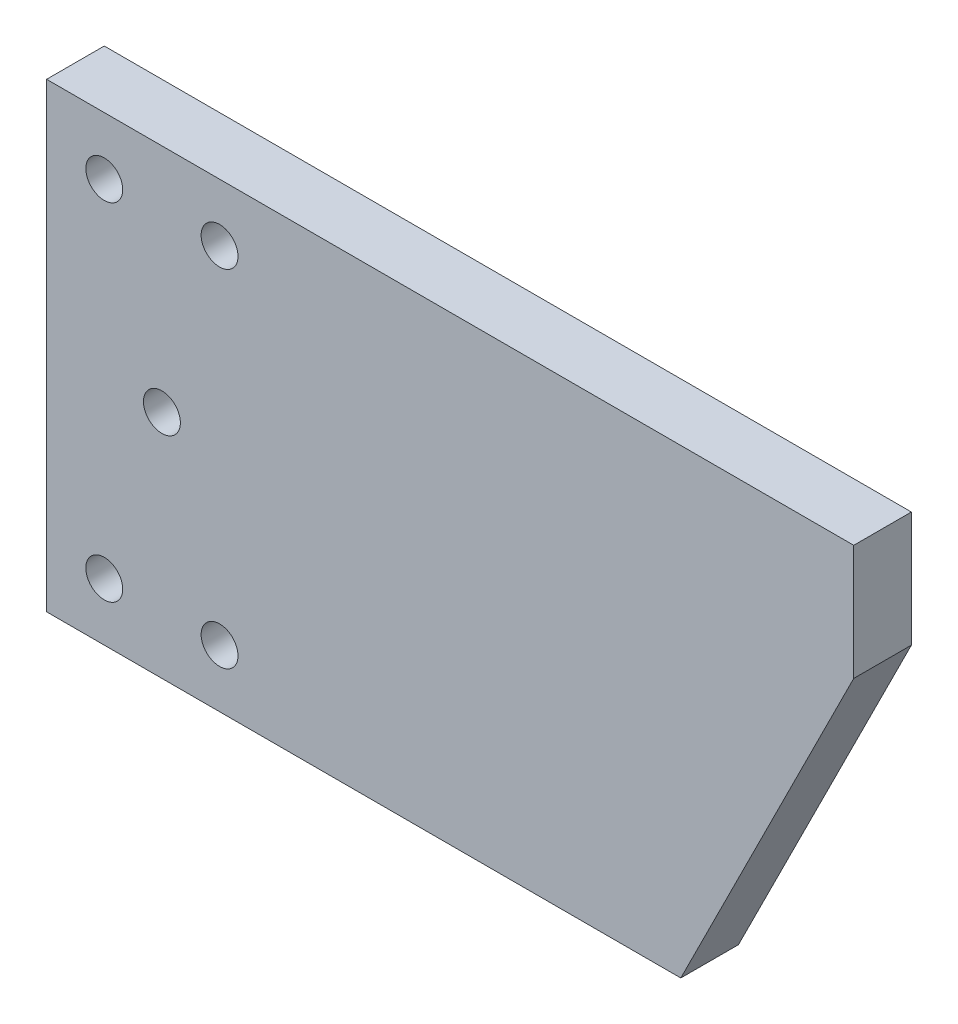
from build123d import *

# Parameters (mm, degrees)
SKETCH1_R           = 2.032
BOSS_EXTRUDE1_DEPTH = 6.35


with BuildPart() as part:
    # Sketch1 → Boss-Extrude1 (new body)
    with BuildSketch(Plane.XY):
        Polygon((69.85, 0), (88.9, 38.1), (88.9, 50.8), (0, 50.8), (0, 0), align=None)
        with Locations((6.35, 6.35)):
            Circle(SKETCH1_R, mode=Mode.SUBTRACT)
        with Locations((19.05, 6.35)):
            Circle(SKETCH1_R, mode=Mode.SUBTRACT)
        with Locations((19.05, 44.45)):
            Circle(SKETCH1_R, mode=Mode.SUBTRACT)
        with Locations((6.35, 44.45)):
            Circle(SKETCH1_R, mode=Mode.SUBTRACT)
        with Locations((12.7, 25.4)):
            Circle(SKETCH1_R, mode=Mode.SUBTRACT)
    extrude(amount=BOSS_EXTRUDE1_DEPTH)


solid = part.part
